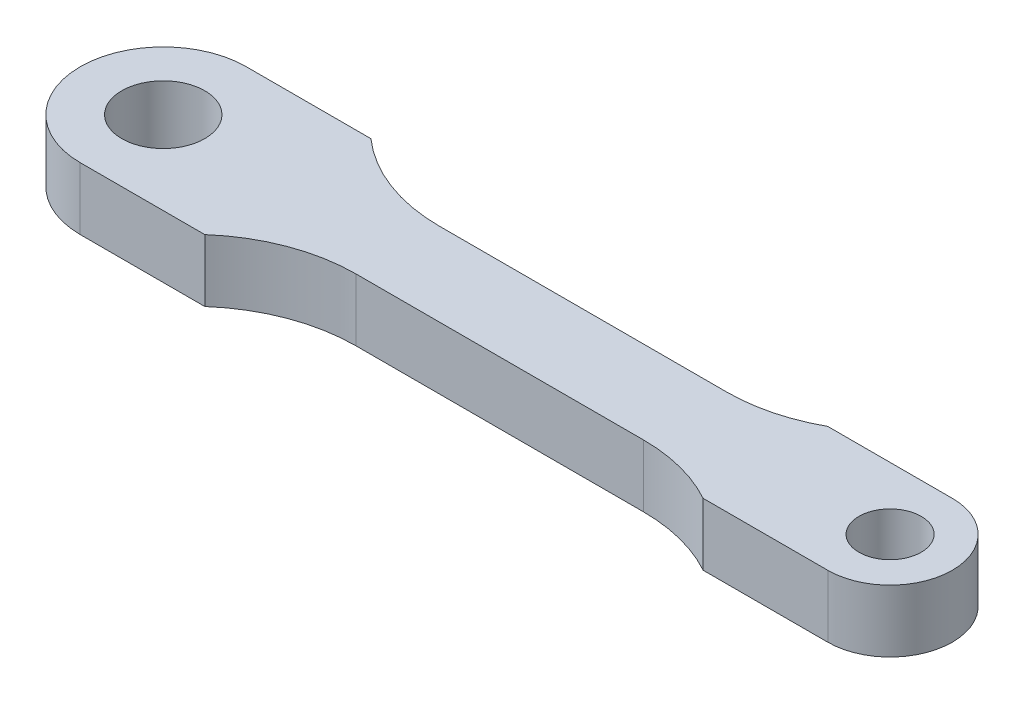
from build123d import *

# Parameters (mm, degrees)
SKETCH2_R           = 2
SKETCH2_R_2         = 1.5
BOSS_EXTRUDE1_DEPTH = 1.5


with BuildPart() as part:
    # Sketch2 → Boss-Extrude1 (new, symmetric)
    with BuildSketch(Plane(origin=(0, 0, 0), x_dir=(1, 0, 0), z_dir=(0, 1, 0))):
        with BuildLine():
            ThreePointArc((-17.5, 4), (-21.5, 0), (-17.5, -4))
            Line((-17.5, -4), (-11.5, -4))
            ThreePointArc((-11.5, -4), (-9.036924503, -2.516685226), (-6.208497378, -2))
            Line((-6.208497378, -2), (7.627016654, -2))
            ThreePointArc((7.627016654, -2), (9.627016654, -2.254033308), (11.5, -3))
            Line((11.5, -3), (17.5, -3))
            ThreePointArc((17.5, -3), (20.5, 0), (17.5, 3))
            Line((17.5, 3), (11.5, 3))
            ThreePointArc((11.5, 3), (9.627016654, 2.254033308), (7.627016654, 2))
            Line((7.627016654, 2), (-6.208497378, 2))
            ThreePointArc((-6.208497378, 2), (-9.036924503, 2.516685226), (-11.5, 4))
            Line((-11.5, 4), (-17.5, 4))
        make_face()
        with Locations(Location((-17.5, 0, 0), (0, 0, 270))):
            Circle(SKETCH2_R, mode=Mode.SUBTRACT)
        with Locations(Location((17.5, 0, 0), (0, 0, 270))):
            Circle(SKETCH2_R_2, mode=Mode.SUBTRACT)
    extrude(amount=BOSS_EXTRUDE1_DEPTH, both=True)


solid = part.part
